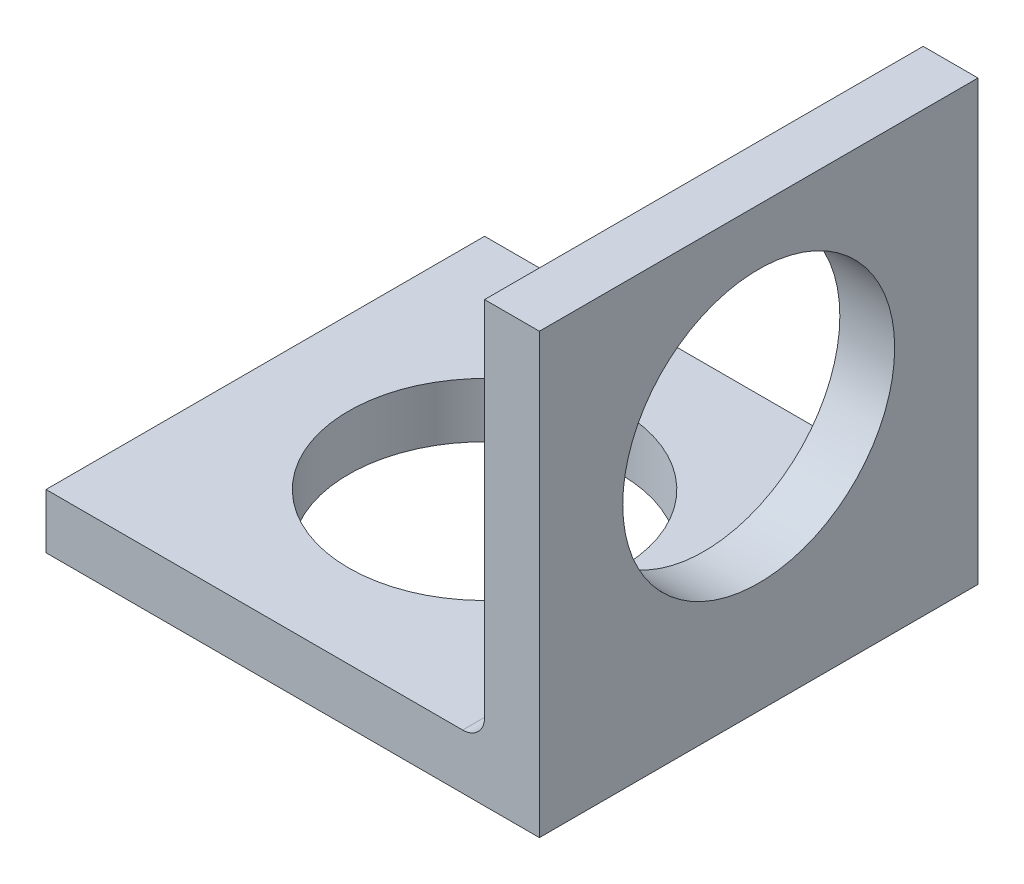
from build123d import *

# Parameters (mm, degrees)
BOSS_EXTRUDE1_DEPTH = 12.7
SKETCH2_R           = 3.937
CUT_EXTRUDE1_DEPTH  = 6.35
SKETCH4_R           = 3.937
CUT_EXTRUDE2_DEPTH  = 6.35
FILLET2_R           = 0.635


with BuildPart() as part:
    # Sketch1 → Boss-Extrude1 (new body)
    with BuildSketch(Plane.XY):
        Polygon((0, 0), (14.2875, 0), (14.2875, 12.7), (12.7, 12.7), (12.7, 1.5875), (0, 1.5875), align=None)
    extrude(amount=BOSS_EXTRUDE1_DEPTH)

    # Sketch2 → Cut-Extrude1 (cut)
    with BuildSketch(Plane.ZY.offset(-12.7)):
        with Locations((6.35, 7.14375)):
            Circle(SKETCH2_R)
    extrude(amount=-CUT_EXTRUDE1_DEPTH, mode=Mode.SUBTRACT)

    # Sketch4 → Cut-Extrude2 (cut)
    with BuildSketch(Plane(origin=(0, 1.5875, 0), x_dir=(1, 0, 0), z_dir=(0, 1, 0))):
        with Locations(Location((6.35, -6.35, 0), (0, 0, 270))):
            Circle(SKETCH4_R)
    extrude(amount=-CUT_EXTRUDE2_DEPTH, mode=Mode.SUBTRACT)

    # Fillet2
    fillet2_edges = [part.edges().sort_by_distance(p)[0] for p in [
        (12.7, 1.5875, 6.35),
    ]]
    fillet(fillet2_edges, radius=FILLET2_R)


solid = part.part
